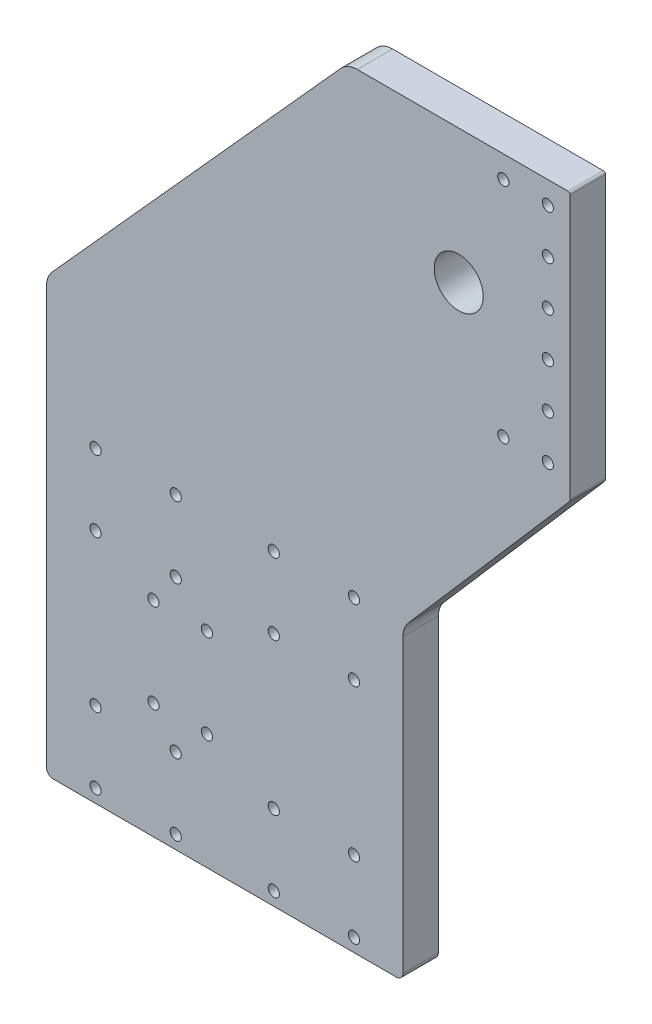
from build123d import *

# Parameters (mm, degrees)
SKETCH1_W           = 160
SKETCH1_H           = 144
SKETCH1_R           = 2.5
BOSS_EXTRUDE1_DEPTH = 15.875
BOSS_EXTRUDE2_DEPTH = 15.875
BOSS_EXTRUDE3_DEPTH = 15.875
FILLET2_R           = 10
SKETCH4_R           = 2.5
CUT_EXTRUDE1_DEPTH  = 314.466131544
FILLET3_R           = 1
SKETCH5_R           = 2.5
CUT_EXTRUDE2_DEPTH  = 314.466131544
FILLET4_R           = 2
SKETCH6_R           = 11
CUT_EXTRUDE3_DEPTH  = 314.466131544
FILLET5_R           = 3


with BuildPart() as part:
    # Sketch1 → Boss-Extrude1 (new body)
    with BuildSketch(Plane.XY):
        Rectangle(SKETCH1_W, SKETCH1_H)
        with Locations((-58, -66)):
            Circle(SKETCH1_R, mode=Mode.SUBTRACT)
        with Locations((-22, -66)):
            Circle(SKETCH1_R, mode=Mode.SUBTRACT)
        with Locations((-58, -34)):
            Circle(SKETCH1_R, mode=Mode.SUBTRACT)
        with Locations((-22, -34)):
            Circle(SKETCH1_R, mode=Mode.SUBTRACT)
        with Locations(Location((58, -66, 0), (0, 0, 180))):
            Circle(SKETCH1_R, mode=Mode.SUBTRACT)
        with Locations(Location((22, -66, 0), (0, 0, 180))):
            Circle(SKETCH1_R, mode=Mode.SUBTRACT)
        with Locations(Location((22, -34, 0), (0, 0, 180))):
            Circle(SKETCH1_R, mode=Mode.SUBTRACT)
        with Locations(Location((58, -34, 0), (0, 0, 180))):
            Circle(SKETCH1_R, mode=Mode.SUBTRACT)
        with Locations(Location((-58, 66, 0), (0, 0, 180))):
            Circle(SKETCH1_R, mode=Mode.SUBTRACT)
        with Locations(Location((-22, 66, 0), (0, 0, 180))):
            Circle(SKETCH1_R, mode=Mode.SUBTRACT)
        with Locations((22, 66)):
            Circle(SKETCH1_R, mode=Mode.SUBTRACT)
        with Locations((58, 66)):
            Circle(SKETCH1_R, mode=Mode.SUBTRACT)
        with Locations((58, 34)):
            Circle(SKETCH1_R, mode=Mode.SUBTRACT)
        with Locations((22, 34)):
            Circle(SKETCH1_R, mode=Mode.SUBTRACT)
        with Locations(Location((-22, 34, 0), (0, 0, 180))):
            Circle(SKETCH1_R, mode=Mode.SUBTRACT)
        with Locations(Location((-58, 34, 0), (0, 0, 180))):
            Circle(SKETCH1_R, mode=Mode.SUBTRACT)
    extrude(amount=BOSS_EXTRUDE1_DEPTH)

    # Sketch2 → Boss-Extrude2 (add, through all)
    with BuildSketch(Plane.XY.offset(15.875)):
        Polygon((55, 272), (155, 272), (155, 152), (80, 152), (80, 72), (-80, 72), (-80, 122), align=None)
    extrude(amount=-BOSS_EXTRUDE2_DEPTH)

    # Sketch3 → Boss-Extrude3 (add, through all)
    with BuildSketch(Plane.XY.offset(15.875)):
        Polygon((155, 152), (80, 65.589776693), (80, 152), align=None)
    extrude(amount=-BOSS_EXTRUDE3_DEPTH)

    # Fillet2
    fillet2_edges = [part.edges().sort_by_distance(p)[0] for p in [
        (80, 65.589776693, 7.9375),
        (-80, 122, 7.9375),
        (55, 272, 7.9375),
    ]]
    fillet(fillet2_edges, radius=FILLET2_R)

    # Sketch4 → Cut-Extrude1 (cut, through all)
    with BuildSketch(Plane.XY.offset(15.875)):
        with Locations((-32, 20)):
            Circle(SKETCH4_R)
        with Locations(Location((-8, 20, 0), (0, 0, 180))):
            Circle(SKETCH4_R)
        with Locations((-8, -20)):
            Circle(SKETCH4_R)
        with Locations(Location((-32, -20, 0), (0, 0, 180))):
            Circle(SKETCH4_R)
    extrude(amount=-CUT_EXTRUDE1_DEPTH, mode=Mode.SUBTRACT)

    # Fillet3
    fillet3_edges = [part.edges().sort_by_distance(p)[0] for p in [
        (155, 272, 7.9375),
    ]]
    fillet(fillet3_edges, radius=FILLET3_R)

    # Sketch5 → Cut-Extrude2 (cut, through all)
    with BuildSketch(Plane.XY.offset(15.875)):
        with Locations((145, 262)):
            Circle(SKETCH5_R)
        with Locations((145, 242)):
            Circle(SKETCH5_R)
        with Locations((145, 222)):
            Circle(SKETCH5_R)
        with Locations((145, 202)):
            Circle(SKETCH5_R)
        with Locations((145, 182)):
            Circle(SKETCH5_R)
        with Locations((145, 162)):
            Circle(SKETCH5_R)
        with Locations((125, 162)):
            Circle(SKETCH5_R)
        with Locations((125, 262)):
            Circle(SKETCH5_R)
    extrude(amount=-CUT_EXTRUDE2_DEPTH, mode=Mode.SUBTRACT)

    # Fillet4
    fillet4_edges = [part.edges().sort_by_distance(p)[0] for p in [
        (155, 152, 7.9375),
    ]]
    fillet(fillet4_edges, radius=FILLET4_R)

    # Sketch6 → Cut-Extrude3 (cut, through all)
    with BuildSketch(Plane.XY.offset(15.875)):
        with Locations((105, 212)):
            Circle(SKETCH6_R)
    extrude(amount=-CUT_EXTRUDE3_DEPTH, mode=Mode.SUBTRACT)

    # Fillet5
    fillet5_edges = [part.edges().sort_by_distance(p)[0] for p in [
        (80, -72, 7.9375),
        (-80, -72, 7.9375),
    ]]
    fillet(fillet5_edges, radius=FILLET5_R)


solid = part.part
